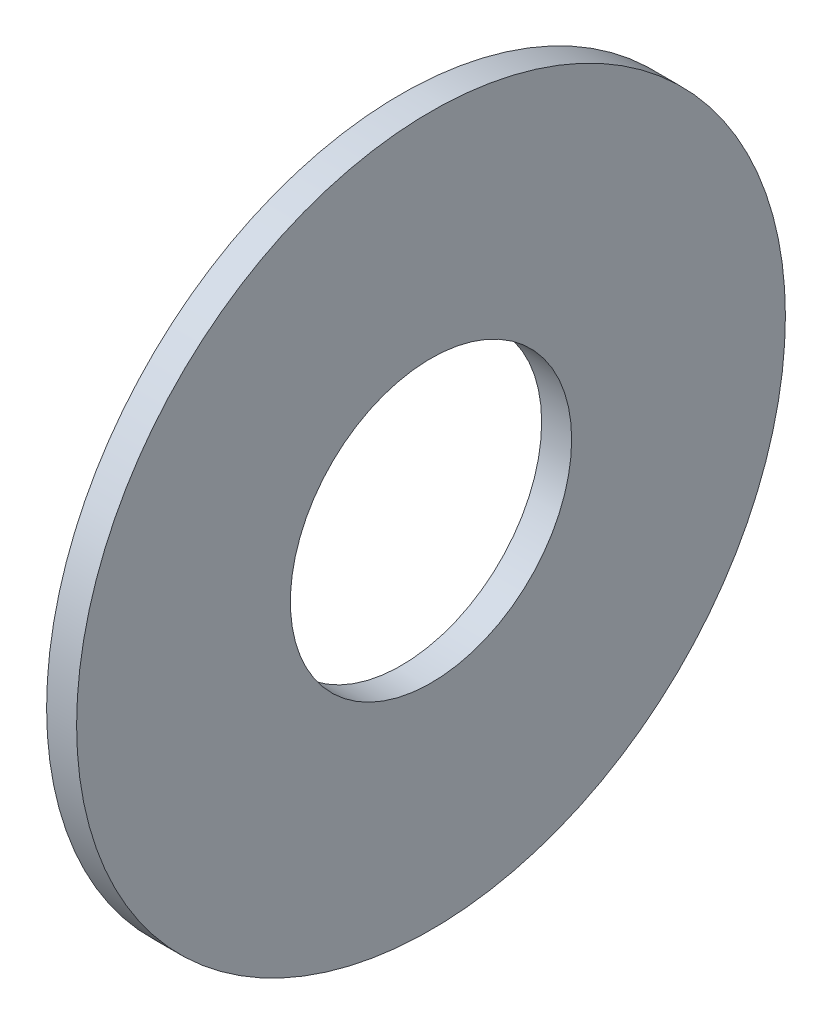
from build123d import *

# Parameters (mm, degrees)
SKETCH1_R           = 6
SKETCH1_R_2         = 2.38125
BOSS_EXTRUDE1_DEPTH = 0.508


with BuildPart() as part:
    # Sketch1 → Boss-Extrude1 (new body)
    with BuildSketch(Plane(origin=(0, 0, 0), x_dir=(0, 0, -1), z_dir=(1, 0, 0))):
        Circle(SKETCH1_R)
        Circle(SKETCH1_R_2, mode=Mode.SUBTRACT)
    extrude(amount=BOSS_EXTRUDE1_DEPTH)


solid = part.part
